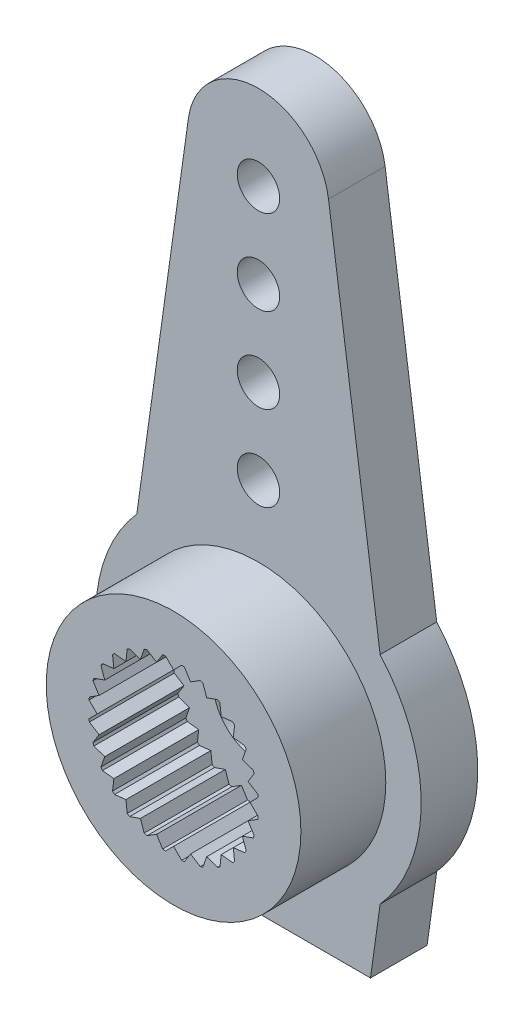
from build123d import *

# Parameters (mm, degrees)
ESQUISSE1_R                  = 5.75
ESQUISSE1_R_2                = 1.6
BOSS_EXTRU_1_DEPTH           = 5
ESQUISSE2_R                  = 3
ENL_V_MAT_EXTRU_1_DEPTH      = 3
ENL_V_START                  = -3
ESQUISSE3_R                  = 5.75
ESQUISSE3_R_2                = 4.5
ENL_V_MAT_EXTRU_2_DEPTH      = 3
BOSS_EXTRU_2_DEPTH           = 2
R_P_TITION_CIRCULAIRE1_COUNT = 2
ESQUISSE5_R                  = 0.75
ENL_V_MAT_EXTRU_3_DEPTH      = 3
R_P_TITION_CIRCULAIRE2_COUNT = 2
BOSS_EXTRU_3_DEPTH           = 3
R_P_TITION_CIRCULAIRE3_COUNT = 28
ENL_V_START_2                = -1
ESQUISSE7_R                  = 3
ESQUISSE7_R_2                = 1.6
ENL_V_MAT_EXTRU_4_DEPTH      = 1
ESQUISSE8_R                  = 4.7
ESQUISSE8_R_2                = 3.4
ENL_V_MAT_EXTRU_5_DEPTH      = 1
WYTNIJ_WYCI_GNI_CIE1_DEPTH   = 10


with BuildPart() as part:
    # Esquisse1 → Boss.-Extru.1 (new body)
    with BuildSketch(Plane.XY):
        Circle(ESQUISSE1_R)
        Circle(ESQUISSE1_R_2, mode=Mode.SUBTRACT)
    extrude(amount=BOSS_EXTRU_1_DEPTH)

    # Esquisse2 → Enlèv. mat.-Extru.1 (cut)
    with BuildSketch(Plane.XY.offset(5)):
        Circle(ESQUISSE2_R)
    extrude(amount=-ENL_V_MAT_EXTRU_1_DEPTH, mode=Mode.SUBTRACT)

    # Esquisse3 → Enlèv. mat.-Extru.2 (cut)
    with BuildSketch(Plane.XY.offset(5).offset(ENL_V_START)):
        Circle(ESQUISSE3_R)
        Circle(ESQUISSE3_R_2, mode=Mode.SUBTRACT)
    extrude(amount=ENL_V_MAT_EXTRU_2_DEPTH, mode=Mode.SUBTRACT)

    # Esquisse4 → Boss.-Extru.2 (add)
    with BuildSketch(Plane(origin=(0, 0, 0), x_dir=(-1, 0, 0), z_dir=(0, 0, -1))):
        with BuildLine():
            Line((-4.3, 3.817394399), (-2.475852955, 16.846629695))
            ThreePointArc((-2.475852955, 16.846629695), (0, 19), (2.475852955, 16.846629695))
            Line((2.475852955, 16.846629695), (4.3, 3.817394399))
            ThreePointArc((4.3, 3.817394399), (0, 5.75), (-4.3, 3.817394399))
        make_face()
    boss_extru_2 = extrude(amount=-BOSS_EXTRU_2_DEPTH)

    # Répétition circulaire1: Boss.-Extru.2 ×2 about axis
    r_p_tition_circulaire1_axis = Axis((0, 0, 0), (0, 0, 1))
    for i in range(1, R_P_TITION_CIRCULAIRE1_COUNT):
        add(boss_extru_2.rotate(r_p_tition_circulaire1_axis, i * 360 / R_P_TITION_CIRCULAIRE1_COUNT))

    # Esquisse5 → Enlèv. mat.-Extru.3 (cut)
    with BuildSketch(Plane(origin=(0, 0, 0), x_dir=(-1, 0, 0), z_dir=(0, 0, -1))):
        with Locations((0, 7)):
            Circle(ESQUISSE5_R)
        with Locations((0, 10)):
            Circle(ESQUISSE5_R)
        with Locations((0, 13)):
            Circle(ESQUISSE5_R)
        with Locations((0, 16)):
            Circle(ESQUISSE5_R)
    enl_v_mat_extru_3 = extrude(amount=-ENL_V_MAT_EXTRU_3_DEPTH, mode=Mode.SUBTRACT)

    # Répétition circulaire2: Enlèv. mat.-Extru.3 ×2 about axis
    r_p_tition_circulaire2_axis = Axis((0, 0, 0), (0, 0, 1))
    for i in range(1, R_P_TITION_CIRCULAIRE2_COUNT):
        add(enl_v_mat_extru_3.rotate(r_p_tition_circulaire2_axis, i * 360 / R_P_TITION_CIRCULAIRE2_COUNT), mode=Mode.SUBTRACT)

    # Esquisse6 → Boss.-Extru.3 (add)
    with BuildSketch(Plane.XY.offset(5)):
        Polygon((-0.3, 3), (0, 2.7), (0.3, 3), align=None)
    boss_extru_3 = extrude(amount=-BOSS_EXTRU_3_DEPTH)

    # Répétition circulaire3: Boss.-Extru.3 ×28 about axis
    r_p_tition_circulaire3_axis = Axis((0, 0, 0), (0, 0, 1))
    for i in range(1, R_P_TITION_CIRCULAIRE3_COUNT):
        add(boss_extru_3.rotate(r_p_tition_circulaire3_axis, i * 360 / R_P_TITION_CIRCULAIRE3_COUNT))

    # Esquisse7 → Enlèv. mat.-Extru.4 (cut)
    with BuildSketch(Plane(origin=(0, 0, 0), x_dir=(-1, 0, 0), z_dir=(0, 0, -1)).offset(ENL_V_START_2)):
        Circle(ESQUISSE7_R)
        Circle(ESQUISSE7_R_2, mode=Mode.SUBTRACT)
    extrude(amount=ENL_V_MAT_EXTRU_4_DEPTH, mode=Mode.SUBTRACT)

    # Esquisse8 → Enlèv. mat.-Extru.5 (cut)
    with BuildSketch(Plane(origin=(0, 0, 0), x_dir=(-1, 0, 0), z_dir=(0, 0, -1))):
        Circle(ESQUISSE8_R)
        Circle(ESQUISSE8_R_2, mode=Mode.SUBTRACT)
    extrude(amount=-ENL_V_MAT_EXTRU_5_DEPTH, mode=Mode.SUBTRACT)

    # Szkic1 → Wytnij-wyciągnięcie1 (cut)
    with BuildSketch(Plane(origin=(0, 0, 0), x_dir=(-1, 0, 0), z_dir=(0, 0, -1))):
        with BuildLine():
            Line((3.959425115, -6.25), (-3.959425115, -6.25))
            Line((-3.959425115, -6.25), (-2.475852955, -16.846629695))
            ThreePointArc((-2.475852955, -16.846629695), (0, -19), (2.475852955, -16.846629695))
            Line((2.475852955, -16.846629695), (3.959425115, -6.25))
        make_face()
    extrude(amount=-WYTNIJ_WYCI_GNI_CIE1_DEPTH, mode=Mode.SUBTRACT)


solid = part.part
